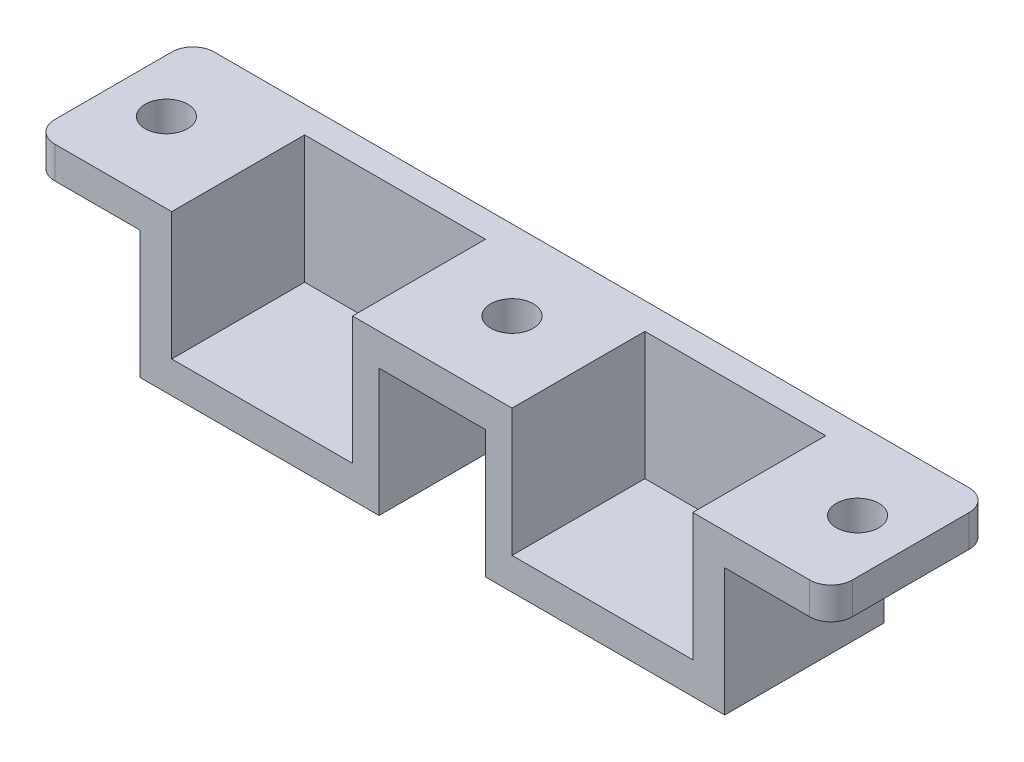
from build123d import *

# Parameters (mm, degrees)
SKETCH1_W             = 75
SKETCH1_H             = 15
BOSS_EXTRUDE1_DEPTH   = 15
SKETCH2_W             = 17
SKETCH2_H             = 12.5
CUT_EXTRUDE1_DEPTH    = 12
SKETCH3_W             = 10
SKETCH3_H             = 15
CUT_EXTRUDE2_DEPTH    = 12
F_4_0MM_DOWEL_HOLE2_D = 4
FILLET1_R             = 2


with BuildPart() as part:
    # Sketch1 → Boss-Extrude1 (new body)
    with BuildSketch(Plane(origin=(0, 0, 0), x_dir=(1, 0, 0), z_dir=(0, 1, 0))):
        Rectangle(SKETCH1_W, SKETCH1_H)
    extrude(amount=BOSS_EXTRUDE1_DEPTH)

    # Sketch2 → Cut-Extrude1 (cut)
    with BuildSketch(Plane(origin=(0, 15, 0), x_dir=(1, 0, 0), z_dir=(0, 1, 0))):
        with Locations((-16, -1.25)):
            Rectangle(SKETCH2_W, SKETCH2_H)
        with Locations((16, -1.25)):
            Rectangle(SKETCH2_W, SKETCH2_H)
    extrude(amount=-CUT_EXTRUDE1_DEPTH, mode=Mode.SUBTRACT)

    # Sketch3 → Cut-Extrude2 (cut)
    with BuildSketch(Plane.XZ):
        with Locations((-32.5, 0)):
            Rectangle(SKETCH3_W, SKETCH3_H)
        with Locations((32.5, 0)):
            Rectangle(SKETCH3_W, SKETCH3_H)
        Rectangle(SKETCH3_W, SKETCH3_H)
    extrude(amount=-CUT_EXTRUDE2_DEPTH, mode=Mode.SUBTRACT)

    # Ø4.0mm Dowel Hole2 (through all)
    with Locations(Plane(origin=(0, 12, 0), x_dir=(-1, 0, 0), z_dir=(0, -1, 0))):
        with Locations((32.5, 0), (0, 0), (-32.5, 0)):
            Hole(F_4_0MM_DOWEL_HOLE2_D / 2)

    # Fillet1
    fillet1_edges = [part.edges().sort_by_distance(p)[0] for p in [
        (-37.5, 13.5, -7.5),
        (37.5, 13.5, -7.5),
        (37.5, 13.5, 7.5),
        (-37.5, 13.5, 7.5),
    ]]
    fillet(fillet1_edges, radius=FILLET1_R)


solid = part.part
